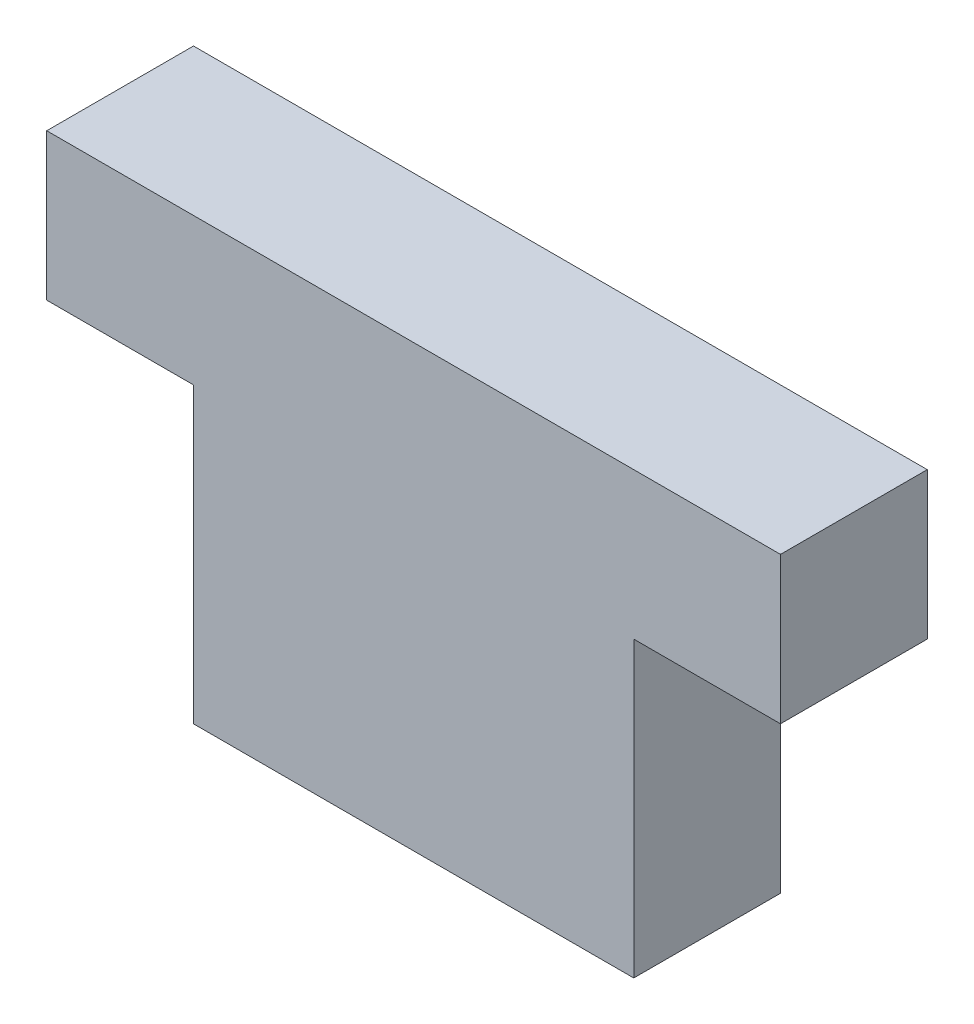
from build123d import *

# Parameters (mm, degrees)
BOSS_EXTRUDE1_DEPTH = 5


with BuildPart() as part:
    # Sketch1 → Boss-Extrude1 (new body)
    with BuildSketch(Plane.XY):
        Polygon((0, 10), (5, 10), (5, 15), (-20, 15), (-20, 10), (-15, 10), (-15, 0), (0, 0), align=None)
    extrude(amount=BOSS_EXTRUDE1_DEPTH)


solid = part.part
